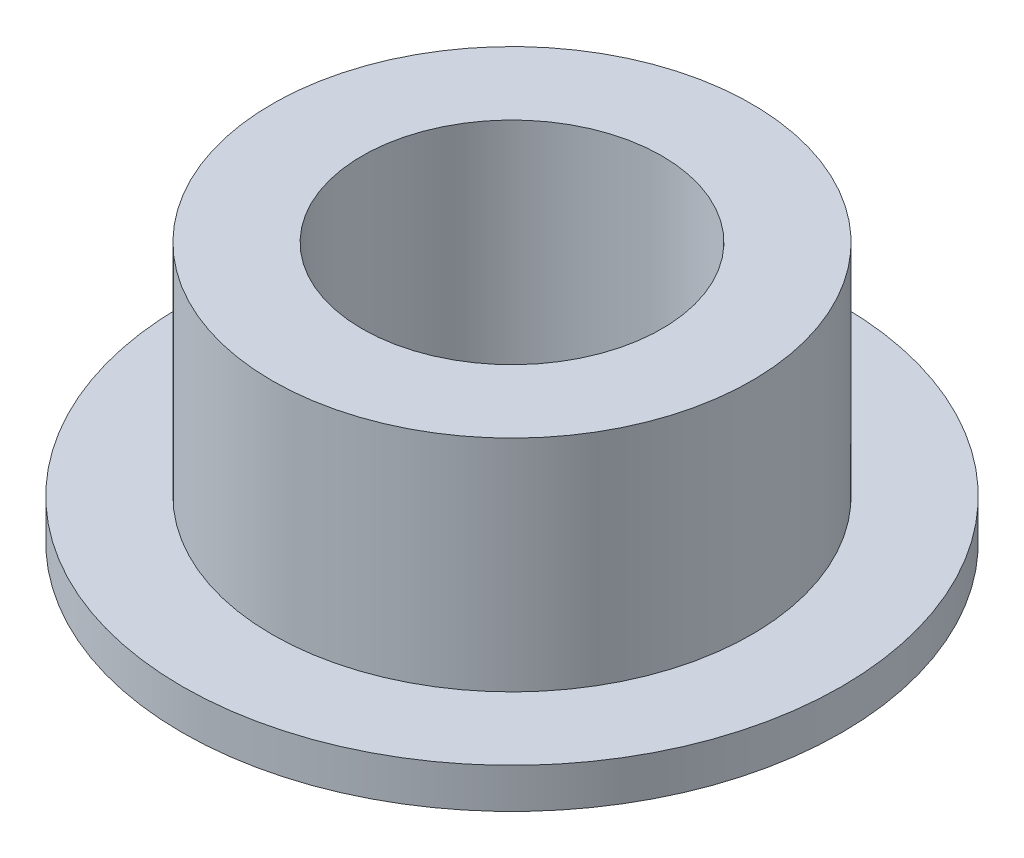
from build123d import *

# Parameters (mm, degrees)
SKETCH1_R           = 16.5
BOSS_EXTRUDE1_DEPTH = 2
SKETCH2_R           = 12
BOSS_EXTRUDE2_DEPTH = 11
SKETCH3_R           = 9
CUT_EXTRUDE1_DEPTH  = 1
SKETCH4_R           = 7.5
CUT_EXTRUDE2_DEPTH  = 12


with BuildPart() as part:
    # Sketch1 → Boss-Extrude1 (new body)
    with BuildSketch(Plane(origin=(0, 0, 0), x_dir=(1, 0, 0), z_dir=(0, 1, 0))):
        with Locations(Location((0, 0, 0), (0, 0, 270))):
            Circle(SKETCH1_R)
    extrude(amount=BOSS_EXTRUDE1_DEPTH)

    # Sketch2 → Boss-Extrude2 (add)
    with BuildSketch(Plane(origin=(0, 2, 0), x_dir=(1, 0, 0), z_dir=(0, 1, 0))):
        with Locations(Location((0, 0, 0), (0, 0, 270))):
            Circle(SKETCH2_R)
    extrude(amount=BOSS_EXTRUDE2_DEPTH)

    # Sketch3 → Cut-Extrude1 (cut)
    with BuildSketch(Plane.XZ):
        with Locations(Location((0, 0, 0), (0, 0, 270))):
            Circle(SKETCH3_R)
    extrude(amount=-CUT_EXTRUDE1_DEPTH, mode=Mode.SUBTRACT)

    # Sketch4 → Cut-Extrude2 (cut)
    with BuildSketch(Plane(origin=(0, 13, 0), x_dir=(1, 0, 0), z_dir=(0, 1, 0))):
        with Locations(Location((0, 0, 0), (0, 0, 270))):
            Circle(SKETCH4_R)
    extrude(amount=-CUT_EXTRUDE2_DEPTH, mode=Mode.SUBTRACT)


solid = part.part
